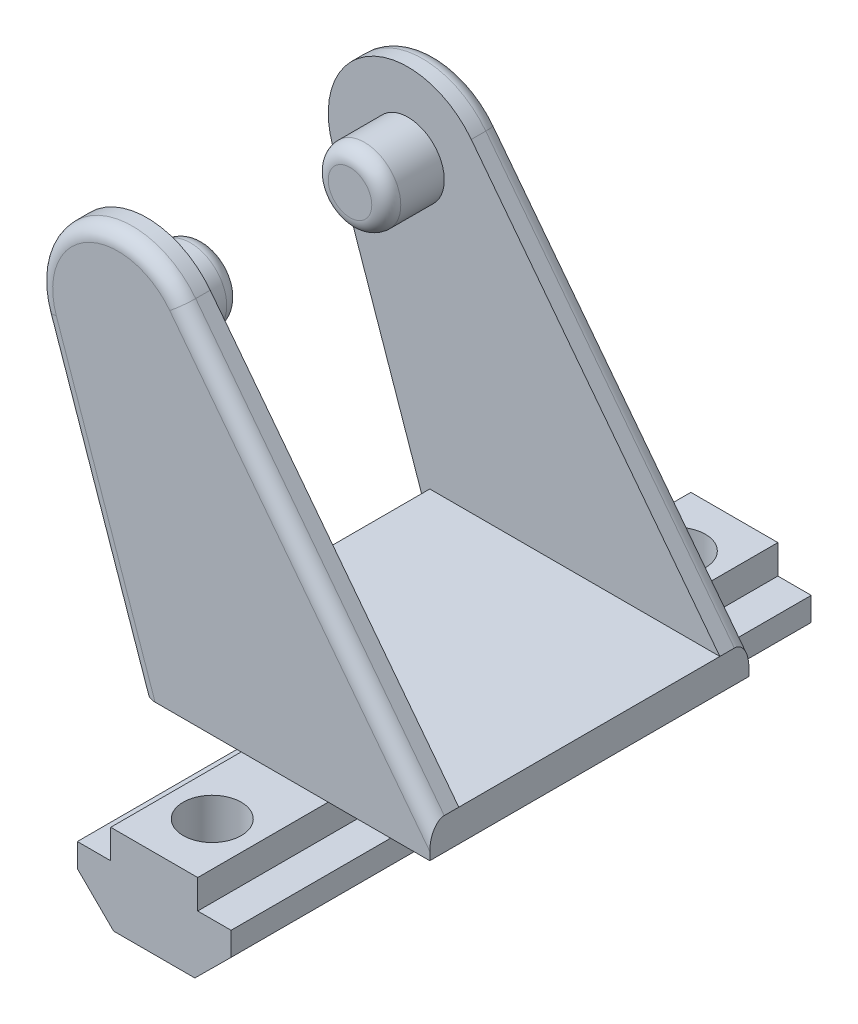
from build123d import *

# Parameters (mm, degrees)
BOSS_EXTRUDE1_DEPTH  = 20
SKETCH2_W            = 20
SKETCH2_H            = 22
BOSS_EXTRUDE2_DEPTH  = 2.2
BOSS_EXTRUDE3_DEPTH  = 2
SKETCH5_R            = 2.5
BOSS_EXTRUDE4_DEPTH  = 4
FILLET1_R            = 1
FILLET2_R            = 1
FILLET1_OF_MIRROR1_R = 1
FILLET2_OF_MIRROR1_R = 1
SKETCH6_R            = 2
CUT_EXTRUDE1_DEPTH   = 38.406182644


with BuildPart() as part:
    # Sketch1 → Boss-Extrude1 (new, symmetric)
    with BuildSketch(Plane.XY):
        Polygon((-3, 0), (3, 0), (3, -2), (5.3, -2), (5.3, -3.62), (2.8, -6.1), (-2.8, -6.1), (-5.3, -3.62), (-5.3, -2), (-3, -2), align=None)
    extrude(amount=BOSS_EXTRUDE1_DEPTH, both=True)

    # Sketch2 → Boss-Extrude2 (add)
    with BuildSketch(Plane(origin=(0, 0, 0), x_dir=(1, 0, 0), z_dir=(0, 1, 0))):
        Rectangle(SKETCH2_W, SKETCH2_H)
    extrude(amount=BOSS_EXTRUDE2_DEPTH)

    # Sketch4 → Boss-Extrude3 (add)
    with BuildSketch(Plane.XY.offset(11)):
        with BuildLine():
            Line((-3, 0), (3, 0))
            Line((3, 0), (10, 0))
            Line((10, 0), (10, 2.2))
            Line((10, 2.2), (-7.139065943, 24.501455527))
            ThreePointArc((-7.139065943, 24.501455527), (-14.108916266, 25.991854595), (-16.69750329, 19.351122698))
            Line((-16.69750329, 19.351122698), (-10, 0))
            Line((-10, 0), (-3, 0))
        make_face()
    boss_extrude3 = extrude(amount=-BOSS_EXTRUDE3_DEPTH)

    # Sketch5 → Boss-Extrude4 (add)
    with BuildSketch(Plane(origin=(0, 0, 9), x_dir=(-1, 0, 0), z_dir=(0, 0, -1))):
        with Locations(Location((11.5, 21.15, 0), (0, 0, 180))):
            Circle(SKETCH5_R)
    boss_extrude4 = extrude(amount=BOSS_EXTRUDE4_DEPTH)

    # Fillet1
    fillet1_edges = [part.edges().sort_by_distance(p)[0] for p in [
        (-14, 21.15, 5),
    ]]
    fillet(fillet1_edges, radius=FILLET1_R)

    # Fillet2
    fillet2_edges = [part.edges().sort_by_distance(p)[0] for p in [
        (1.430467029, 13.350727763, 11),
        (-14.108916266, 25.991854595, 11),
        (-13.348751645, 9.675561349, 11),
    ]]
    fillet(fillet2_edges, radius=FILLET2_R)

    # Mirror1: Boss-Extrude3, Boss-Extrude4 across plane
    add(boss_extrude3.mirror(Plane.XY))
    add(boss_extrude4.mirror(Plane.XY))

    # Fillet1 of Mirror1
    fillet1_of_mirror1_edges = [part.edges().sort_by_distance(p)[0] for p in [
        (-14, 21.15, -5),
    ]]
    fillet(fillet1_of_mirror1_edges, radius=FILLET1_OF_MIRROR1_R)

    # Fillet2 of Mirror1
    fillet2_of_mirror1_edges = [part.edges().sort_by_distance(p)[0] for p in [
        (1.430467029, 13.350727763, -11),
        (-14.108916266, 25.991854595, -11),
        (-13.348751645, 9.675561349, -11),
    ]]
    fillet(fillet2_of_mirror1_edges, radius=FILLET2_OF_MIRROR1_R)

    # Sketch6 → Cut-Extrude1 (cut, through all)
    with BuildSketch(Plane(origin=(0, 0, 0), x_dir=(1, 0, 0), z_dir=(0, 1, 0))):
        with Locations(Location((0, 16, 0), (0, 0, 270))):
            Circle(SKETCH6_R)
        with Locations(Location((0, -16, 0), (0, 0, 270))):
            Circle(SKETCH6_R)
    extrude(amount=-CUT_EXTRUDE1_DEPTH, mode=Mode.SUBTRACT)


solid = part.part
